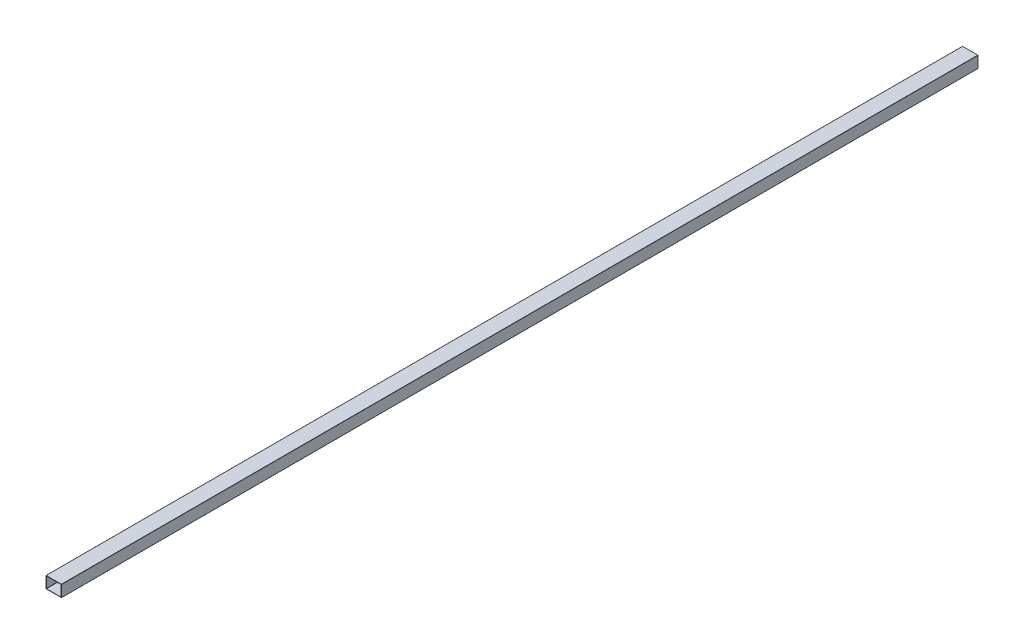
from build123d import *

# Parameters (mm, degrees)
CROQUIS1_W              = 101.6
CROQUIS1_H              = 76.2
CROQUIS1_W_2            = 97.82
CROQUIS1_H_2            = 72.42
SALIENTE_EXTRUIR1_DEPTH = 6000
REDONDEO1_R             = 1


with BuildPart() as part:
    # Croquis1 → Saliente-Extruir1 (new body)
    with BuildSketch(Plane.XY):
        Rectangle(CROQUIS1_W, CROQUIS1_H)
        Rectangle(CROQUIS1_W_2, CROQUIS1_H_2, mode=Mode.SUBTRACT)
    extrude(amount=-SALIENTE_EXTRUIR1_DEPTH)

    # Redondeo1
    redondeo1_edges = [part.edges().sort_by_distance(p)[0] for p in [
        (48.91, -36.21, -3000),
        (-48.91, -36.21, -3000),
        (-48.91, 36.21, -3000),
        (48.91, 36.21, -3000),
        (50.8, -38.1, -3000),
        (-50.8, -38.1, -3000),
        (-50.8, 38.1, -3000),
        (50.8, 38.1, -3000),
    ]]
    fillet(redondeo1_edges, radius=REDONDEO1_R)


solid = part.part
